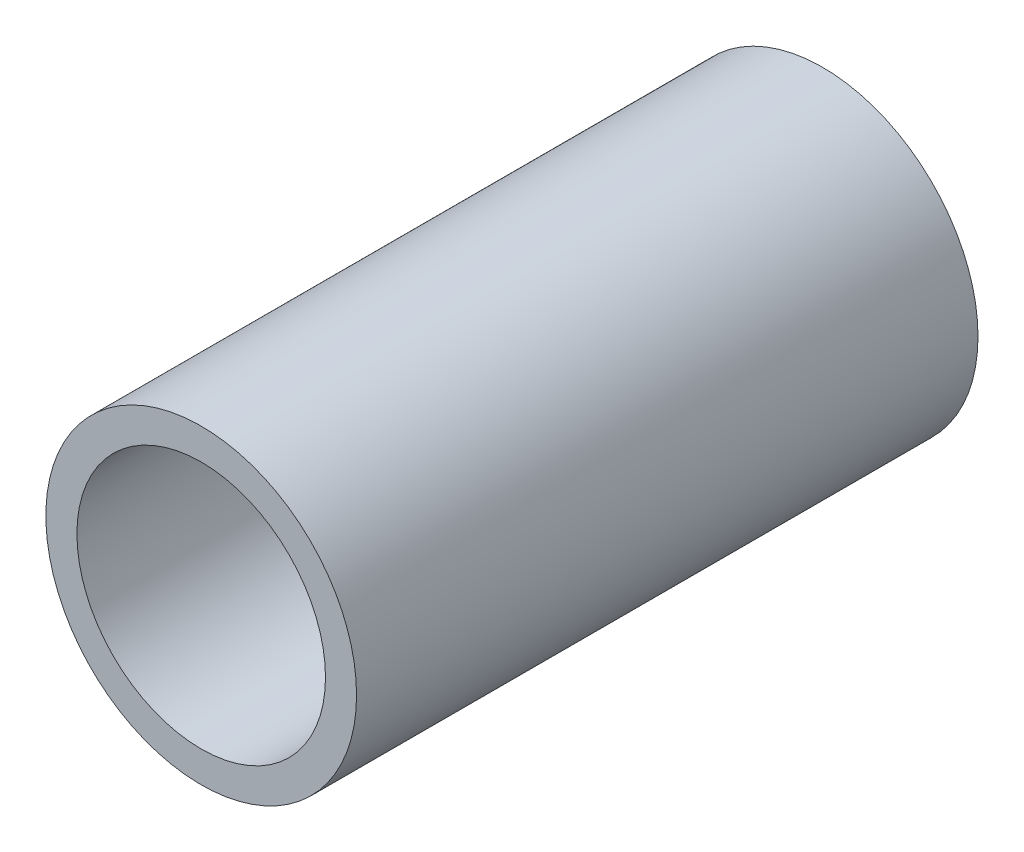
from build123d import *

# Parameters (mm, degrees)
SKETCH1_R           = 63.5
BOSS_EXTRUDE1_DEPTH = 127
SKETCH2_R           = 50.8
CUT_EXTRUDE1_DEPTH  = 270.407683632


with BuildPart() as part:
    # Sketch1 → Boss-Extrude1 (new, symmetric)
    with BuildSketch(Plane.XY):
        Circle(SKETCH1_R)
    extrude(amount=BOSS_EXTRUDE1_DEPTH, both=True)

    # Sketch2 → Cut-Extrude1 (cut, through all)
    with BuildSketch(Plane.XY.offset(127)):
        Circle(SKETCH2_R)
    extrude(amount=-CUT_EXTRUDE1_DEPTH, mode=Mode.SUBTRACT)


solid = part.part
